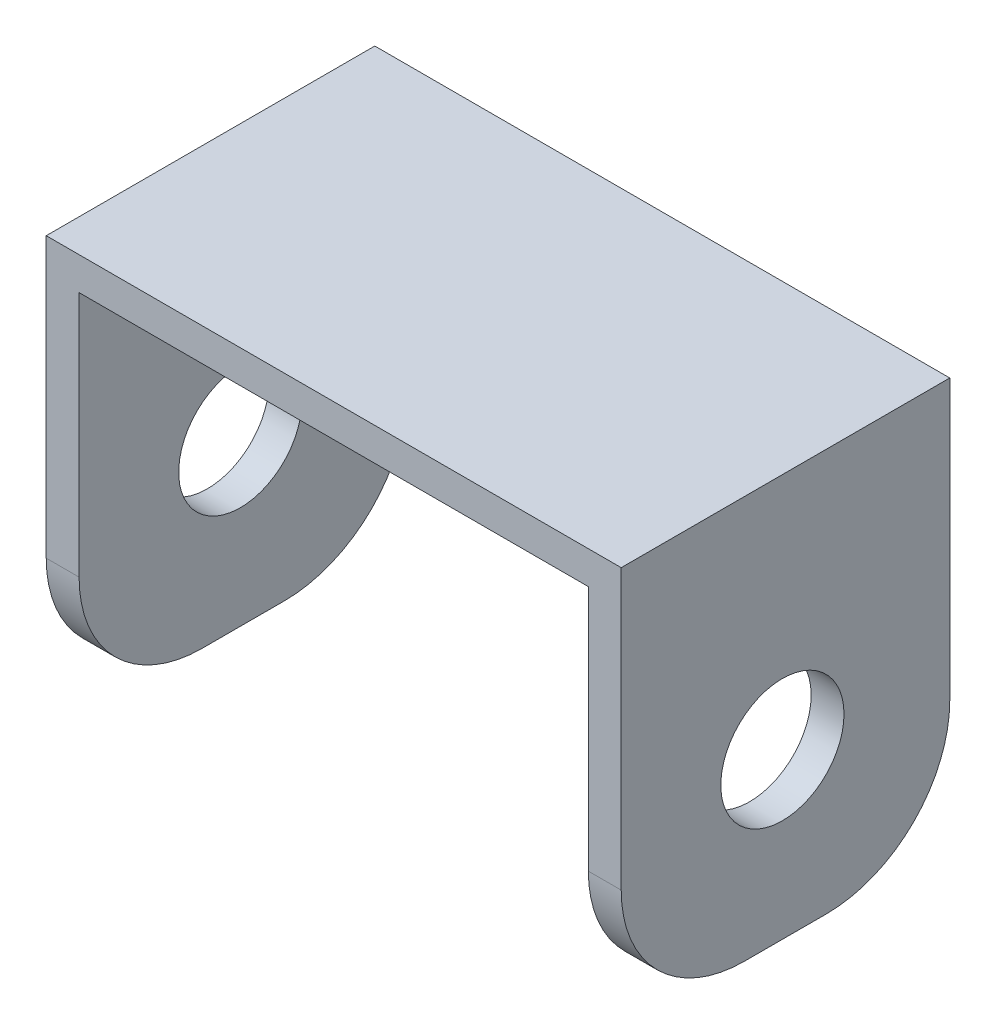
from build123d import *

# Parameters (mm, degrees)
SKETCH1_W           = 35.56
SKETCH1_H           = 20.32
BOSS_EXTRUDE1_DEPTH = 2.032
SKETCH2_W           = 2.032
SKETCH2_H           = 20.32
BOSS_EXTRUDE2_DEPTH = 22.86
FILLET1_R           = 7.62
SKETCH3_R           = 3.81
CUT_EXTRUDE1_DEPTH  = 49.022


with BuildPart() as part:
    # Sketch1 → Boss-Extrude1 (new body)
    with BuildSketch(Plane(origin=(0, 0, 0), x_dir=(1, 0, 0), z_dir=(0, 1, 0))):
        with Locations((3.501518098, 0.190585347)):
            Rectangle(SKETCH1_W, SKETCH1_H)
    extrude(amount=BOSS_EXTRUDE1_DEPTH)

    # Sketch2 → Boss-Extrude2 (add)
    with BuildSketch(Plane.XZ):
        with Locations((-13.262481902, -0.190585347)):
            Rectangle(SKETCH2_W, SKETCH2_H)
        with Locations((20.265518098, -0.190585347)):
            Rectangle(SKETCH2_W, SKETCH2_H)
    extrude(amount=BOSS_EXTRUDE2_DEPTH)

    # Fillet1
    fillet1_edges = [part.edges().sort_by_distance(p)[0] for p in [
        (-13.262481902, -22.86, -10.350585347),
        (-13.262481902, -22.86, 9.969414653),
        (20.265518098, -22.86, 9.969414653),
        (20.265518098, -22.86, -10.350585347),
    ]]
    fillet(fillet1_edges, radius=FILLET1_R)

    # Sketch3 → Cut-Extrude1 (cut)
    with BuildSketch(Plane(origin=(21.281518098, 0, 0), x_dir=(0, 0, -1), z_dir=(1, 0, 0))):
        with Locations((0, -12.7)):
            Circle(SKETCH3_R)
    extrude(amount=-CUT_EXTRUDE1_DEPTH, mode=Mode.SUBTRACT)


solid = part.part
